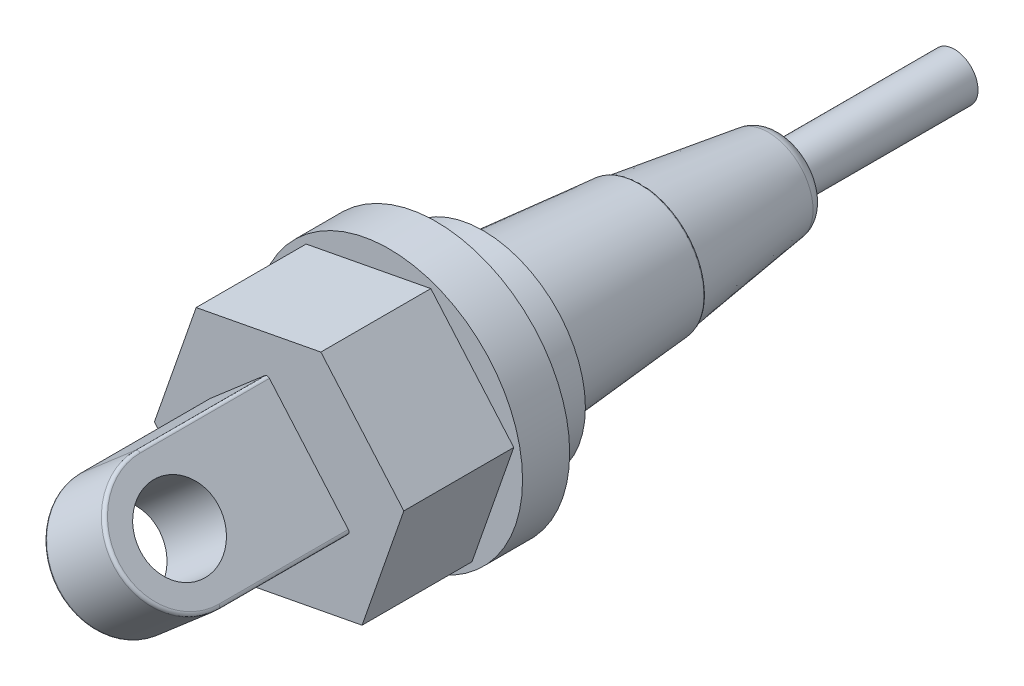
from build123d import *

# Parameters (mm, degrees)
SKETCH_1_R      = 8.5
EXTRUDE_1_DEPTH = 3
EXTRUDE_2_DEPTH = 7
SKETCH_3_R      = 6.5
EXTRUDE_3_DEPTH = 3
SKETCH_4_R      = 5
EXTRUDE_4_DEPTH = 10
EXTRUDE_4_TAPER = 5
SKETCH_5_R      = 4
EXTRUDE_5_DEPTH = 9
EXTRUDE_5_TAPER = 8
FILLET_1_R      = 0.1
FILLET_2_R      = 1
SKETCH_7_R      = 2.5
EXTRUDE_6_DEPTH = 2.5
FILLET_3_R      = 0.2
SKETCH_8_R      = 1.5
EXTRUDE_7_DEPTH = 11


with BuildPart() as part:
    # 草图1 → 凸台-拉伸1 (new body)
    with BuildSketch(Plane.XY):
        with Locations((0, 6.282173928)):
            Circle(SKETCH_1_R)
    extrude(amount=EXTRUDE_1_DEPTH)

    # 草图2 → 凸台-拉伸2 (add)
    with BuildSketch(Plane.XY.offset(3)):
        Polygon((5.281387937, 0.163328057), (7.939769935, 7.796567113), (2.658381997, 13.915412984), (-5.281387937, 12.401019799), (-7.939769935, 4.767780743), (-2.658381997, -1.351065128), align=None)
    extrude(amount=EXTRUDE_2_DEPTH)

    # 草图3 → 凸台-拉伸3 (add)
    with BuildSketch(Plane(origin=(0, 0, 0), x_dir=(-1, 0, 0), z_dir=(0, 0, -1))):
        with Locations(Location((0, 6.282173928, 0), (0, 0, 180))):
            Circle(SKETCH_3_R)
    extrude(amount=EXTRUDE_3_DEPTH)

    # 草图4 → 凸台-拉伸4 (add)
    with BuildSketch(Plane(origin=(0, 0, -3), x_dir=(-1, 0, 0), z_dir=(0, 0, -1))):
        with Locations((0, 6.282173928)):
            Circle(SKETCH_4_R)
    extrude(amount=EXTRUDE_4_DEPTH, taper=EXTRUDE_4_TAPER)

    # 草图5 → 凸台-拉伸5 (add)
    with BuildSketch(Plane(origin=(0, 0, -13), x_dir=(-1, 0, 0), z_dir=(0, 0, -1))):
        with Locations((0, 6.282173928)):
            Circle(SKETCH_5_R)
    extrude(amount=EXTRUDE_5_DEPTH, taper=EXTRUDE_5_TAPER)

    # 圆角1
    fillet_1_edges = [part.edges().sort_by_distance(p)[0] for p in [
        (4.125113365, 6.282173928, -13),
    ]]
    fillet(fillet_1_edges, radius=FILLET_1_R)

    # 圆角2
    fillet_2_edges = [part.edges().sort_by_distance(p)[0] for p in [
        (2.735132488, 6.282173928, -22),
    ]]
    fillet(fillet_2_edges, radius=FILLET_2_R)

    # 草图7 → 凸台-拉伸6 (add, symmetric)
    with BuildSketch(Plane(origin=(3.107368239, 2.682077222, 0), x_dir=(0, 0, 1), z_dir=(-0.7570108522857268, -0.6534023029662793, 0))):
        with BuildLine():
            Line((10, 8.797125724), (18.23150741, 8.797125724))
            ThreePointArc((18.23150741, 8.797125724), (22.272959294, 4.755673839), (18.23150741, 0.714221955))
            Line((18.23150741, 0.714221955), (10, 0.714221955))
            Line((10, 0.714221955), (10, 8.797125724))
        make_face()
        with Locations(Location((18.23150741, 4.755673839, 0), (0, 0, 270))):
            Circle(SKETCH_7_R, mode=Mode.SUBTRACT)
    extrude(amount=EXTRUDE_6_DEPTH, both=True)

    # 圆角3
    fillet_3_edges = [part.edges().sort_by_distance(p)[0] for p in [
        (0.748166838, 1.589245235, 14.115753705),
        (-1.892527131, 4.648668171, 22.272959294),
        (-4.533221099, 7.708091106, 14.115753705),
        (4.533221099, 4.85625675, 14.115753705),
        (1.892527131, 7.915679685, 22.272959294),
        (-0.748166838, 10.975102621, 14.115753705),
    ]]
    fillet(fillet_3_edges, radius=FILLET_3_R)

    # 草图8 → 凸台-拉伸7 (add)
    with BuildSketch(Plane(origin=(0, 0, -22), x_dir=(-1, 0, 0), z_dir=(0, 0, -1))):
        with Locations((0, 6.282173928)):
            Circle(SKETCH_8_R)
    extrude(amount=EXTRUDE_7_DEPTH)


solid = part.part
